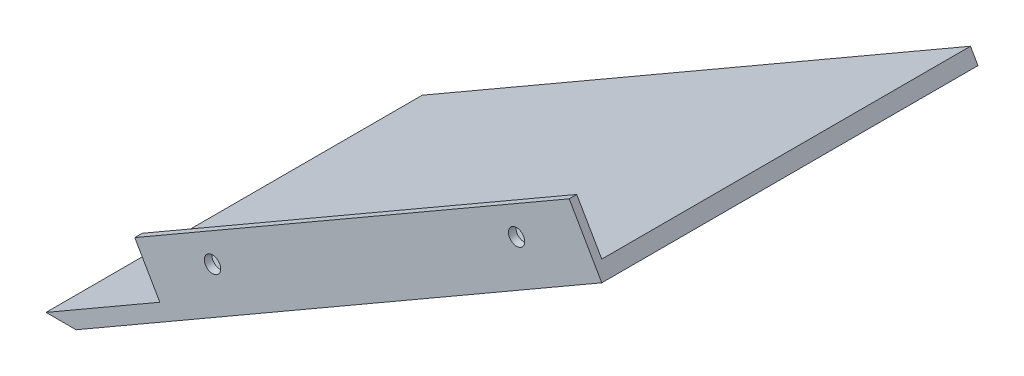
from build123d import *

# Parameters (mm, degrees)
BOSS_EXTRUDE1_DEPTH = 75
SKETCH2_W           = 100
SKETCH2_H           = 1.5
BOSS_EXTRUDE2_DEPTH = 10
SKETCH3_R           = 1.625
CUT_EXTRUDE1_DEPTH  = 152.825931424


with BuildPart() as part:
    # Sketch1 → Boss-Extrude1 (new body)
    with BuildSketch(Plane.XY):
        Polygon((0, 0), (6, 0), (110.797734112, 60.505), (109.297734112, 63.103076211), align=None)
    extrude(amount=BOSS_EXTRUDE1_DEPTH)

    # Sketch2 → Boss-Extrude2 (add)
    with BuildSketch(Plane(origin=(0, 0, 0), x_dir=(0.866025403784438, 0.5000000000000012, 0), z_dir=(-0.5000000000000011, 0.8660254037844379, 0))):
        with Locations((76.206152423, -74.25)):
            Rectangle(SKETCH2_W, SKETCH2_H)
    extrude(amount=BOSS_EXTRUDE2_DEPTH)

    # Sketch3 → Cut-Extrude1 (cut, through all)
    with BuildSketch(Plane.XY.offset(75)):
        with Locations((33.198138972, 24.911441429)):
            Circle(SKETCH3_R)
        with Locations((93.807353055, 59.93320323)):
            Circle(SKETCH3_R)
    extrude(amount=-CUT_EXTRUDE1_DEPTH, mode=Mode.SUBTRACT)


solid = part.part
